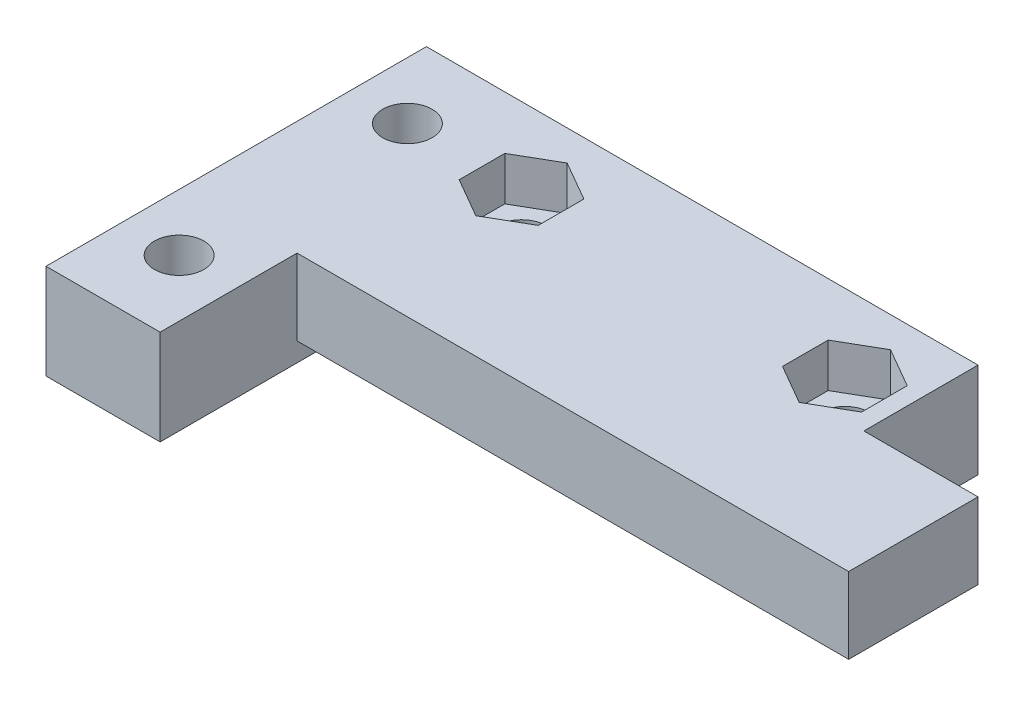
from build123d import *

# Parameters (mm, degrees)
SKETCH_1_W           = 35
SKETCH_1_H           = 20
EXTRUDE_1_DEPTH      = 5
SKETCH_2_W           = 29
SKETCH_2_H           = 14
CUT_EXTRUDE_2_DEPTH  = 1
SKETCH_3_W           = 29
SKETCH_3_H           = 7.2
CUT_EXTRUDE_4_DEPTH  = 41.620192023
SKETCH_4_W           = 6
SKETCH_4_H           = 6
CUT_EXTRUDE_5_DEPTH  = 41.620192023
SKETCH_5_R           = 1.3
CUT_EXTRUDE_6_DEPTH  = 41.620192023
CUT_EXTRUDE_START    = 5
CUT_EXTRUDE_8_DEPTH  = 2.3
SKETCH_6_R           = 2.2
CUT_EXTRUDE_10_DEPTH = 2


with BuildPart() as part:
    # 草圖1 → 填料-伸長1 (new body)
    with BuildSketch(Plane(origin=(0, 0, 0), x_dir=(1, 0, 0), z_dir=(0, 1, 0))):
        with Locations((17.5, 10)):
            Rectangle(SKETCH_1_W, SKETCH_1_H)
    extrude(amount=EXTRUDE_1_DEPTH)

    # 草圖2 → 除料-伸長2 (cut)
    with BuildSketch(Plane(origin=(0, 0, 0), x_dir=(1, 0, 0), z_dir=(0, 1, 0))):
        with Locations((20.5, 7)):
            Rectangle(SKETCH_2_W, SKETCH_2_H)
    extrude(amount=CUT_EXTRUDE_2_DEPTH, mode=Mode.SUBTRACT)

    # 草圖3 → 除料-伸長4 (cut, through all)
    with BuildSketch(Plane(origin=(0, 0, 0), x_dir=(1, 0, 0), z_dir=(0, 1, 0))):
        with Locations((20.5, 3.6)):
            Rectangle(SKETCH_3_W, SKETCH_3_H)
    extrude(amount=CUT_EXTRUDE_4_DEPTH, mode=Mode.SUBTRACT)

    # 草圖4 → 除料-伸長5 (cut, through all)
    with BuildSketch(Plane(origin=(0, 0, 0), x_dir=(1, 0, 0), z_dir=(0, 1, 0))):
        with Locations((32, 17)):
            Rectangle(SKETCH_4_W, SKETCH_4_H)
    extrude(amount=CUT_EXTRUDE_5_DEPTH, mode=Mode.SUBTRACT)

    # 草圖5 → 除料-伸長6 (cut, through all)
    with BuildSketch(Plane(origin=(0, 0, 0), x_dir=(1, 0, 0), z_dir=(0, 1, 0))):
        with Locations(Location((3, 16, 0), (0, 0, 270))):
            Circle(SKETCH_5_R)
        with Locations(Location((3, 4, 0), (0, 0, 270))):
            Circle(SKETCH_5_R)
        with Locations(Location((9, 16, 0), (0, 0, 270))):
            Circle(SKETCH_5_R)
        with Locations(Location((26, 16, 0), (0, 0, 270))):
            Circle(SKETCH_5_R)
    extrude(amount=CUT_EXTRUDE_6_DEPTH, mode=Mode.SUBTRACT)

    # 草圖7 → 除料-伸長8 (cut)
    with BuildSketch(Plane(origin=(0, 0, 0), x_dir=(1, 0, 0), z_dir=(0, 1, 0)).offset(CUT_EXTRUDE_START)):
        Polygon((26, 18.4), (23.921539031, 17.2), (23.921539031, 14.8), (26, 13.6), (28.078460969, 14.8), (28.078460969, 17.2), align=None)
        Polygon((9, 18.4), (6.921539031, 17.2), (6.921539031, 14.8), (9, 13.6), (11.078460969, 14.8), (11.078460969, 17.2), align=None)
    extrude(amount=-CUT_EXTRUDE_8_DEPTH, mode=Mode.SUBTRACT)

    # 草圖6 → 除料-伸長10 (cut)
    with BuildSketch(Plane(origin=(0, 0, 0), x_dir=(1, 0, 0), z_dir=(0, 1, 0))):
        with Locations(Location((3, 16, 0), (0, 0, 90))):
            Circle(SKETCH_6_R)
        with Locations(Location((3, 4, 0), (0, 0, 90))):
            Circle(SKETCH_6_R)
    extrude(amount=CUT_EXTRUDE_10_DEPTH, mode=Mode.SUBTRACT)


solid = part.part
